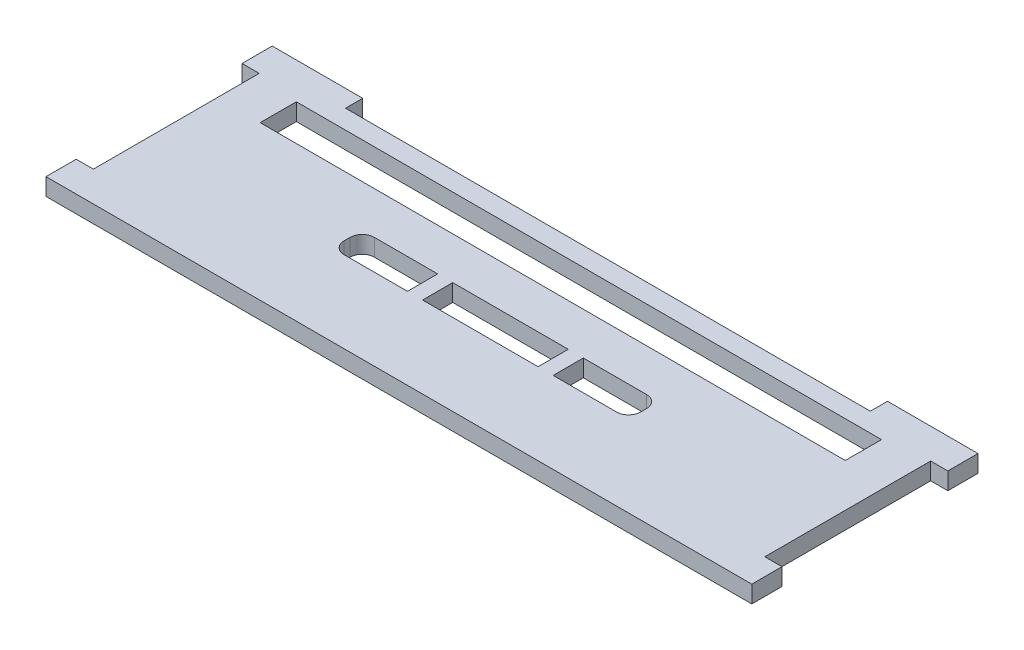
from build123d import *

# Parameters (mm, degrees)
SKETCH1_W           = 234
SKETCH1_H           = 75
BOSS_EXTRUDE1_DEPTH = 5.7
SKETCH2_W           = 5.7
SKETCH2_H           = 55
CUT_EXTRUDE1_DEPTH  = 5.7
SKETCH3_W           = 194
SKETCH3_H           = 12
SKETCH3_W_2         = 38.3
SKETCH3_H_2         = 10
CUT_EXTRUDE2_DEPTH  = 5.7
SKETCH4_W           = 174
SKETCH4_H           = 5.7
CUT_EXTRUDE3_DEPTH  = 5.7
SKETCH6_R           = 1.5
CUT_EXTRUDE4_DEPTH  = 3
SKETCH7_R           = 1.5
CUT_EXTRUDE5_DEPTH  = 3


with BuildPart() as part:
    # Sketch1 → Boss-Extrude1 (new body)
    with BuildSketch(Plane(origin=(0, 0, 0), x_dir=(1, 0, 0), z_dir=(0, 1, 0))):
        with Locations((117, 37.5)):
            Rectangle(SKETCH1_W, SKETCH1_H)
    extrude(amount=BOSS_EXTRUDE1_DEPTH)

    # Sketch2 → Cut-Extrude1 (cut)
    with BuildSketch(Plane(origin=(0, 5.7, 0), x_dir=(1, 0, 0), z_dir=(0, 1, 0))):
        with Locations((2.85, 37.5)):
            Rectangle(SKETCH2_W, SKETCH2_H)
        with Locations((231.15, 37.5)):
            Rectangle(SKETCH2_W, SKETCH2_H)
    extrude(amount=-CUT_EXTRUDE1_DEPTH, mode=Mode.SUBTRACT)

    # Sketch3 → Cut-Extrude2 (cut)
    with BuildSketch(Plane(origin=(0, 5.7, 0), x_dir=(1, 0, 0), z_dir=(0, 1, 0))):
        with Locations((117, 57)):
            Rectangle(SKETCH3_W, SKETCH3_H)
        with Locations((117, 32)):
            Rectangle(SKETCH3_W_2, SKETCH3_H_2)
        with BuildLine():
            Line((92.85, 27), (71.85, 27))
            ThreePointArc((71.85, 27), (69.021572875, 28.171572875), (67.85, 31))
            Line((67.85, 31), (67.85, 33))
            ThreePointArc((67.85, 33), (69.021572875, 35.828427125), (71.85, 37))
            Line((71.85, 37), (92.85, 37))
            Line((92.85, 37), (92.85, 27))
        make_face()
        with BuildLine():
            Line((162.15, 27), (141.15, 27))
            Line((141.15, 27), (141.15, 37))
            Line((141.15, 37), (162.15, 37))
            ThreePointArc((162.15, 37), (164.978427125, 35.828427125), (166.15, 33))
            Line((166.15, 33), (166.15, 31))
            ThreePointArc((166.15, 31), (164.978427125, 28.171572875), (162.15, 27))
        make_face()
    extrude(amount=-CUT_EXTRUDE2_DEPTH, mode=Mode.SUBTRACT)

    # Sketch4 → Cut-Extrude3 (cut)
    with BuildSketch(Plane(origin=(0, 5.7, 0), x_dir=(1, 0, 0), z_dir=(0, 1, 0))):
        with Locations((117, 72.15)):
            Rectangle(SKETCH4_W, SKETCH4_H)
    extrude(amount=-CUT_EXTRUDE3_DEPTH, mode=Mode.SUBTRACT)

    # Sketch6 → Cut-Extrude4 (cut)
    with BuildSketch(Plane.XZ):
        with Locations(Location((152, -66, 0), (0, 0, 270))):
            Circle(SKETCH6_R)
        with Locations(Location((82, -66, 0), (0, 0, 270))):
            Circle(SKETCH6_R)
        with Locations(Location((82, -43.5, 0), (0, 0, 270))):
            Circle(SKETCH6_R)
        with Locations(Location((152, -43.5, 0), (0, 0, 270))):
            Circle(SKETCH6_R)
    extrude(amount=-CUT_EXTRUDE4_DEPTH, mode=Mode.SUBTRACT)

    # Sketch7 → Cut-Extrude5 (cut)
    with BuildSketch(Plane.XZ):
        with Locations(Location((205, -66, 0), (0, 0, 270))):
            Circle(SKETCH7_R)
        with Locations(Location((160, -66, 0), (0, 0, 270))):
            Circle(SKETCH7_R)
        with Locations(Location((160, -46, 0), (0, 0, 270))):
            Circle(SKETCH7_R)
        with Locations(Location((205, -46, 0), (0, 0, 270))):
            Circle(SKETCH7_R)
        with Locations(Location((74, -66, 0), (0, 0, 270))):
            Circle(SKETCH7_R)
        with Locations(Location((29, -66, 0), (0, 0, 270))):
            Circle(SKETCH7_R)
        with Locations(Location((29, -46, 0), (0, 0, 270))):
            Circle(SKETCH7_R)
        with Locations(Location((74, -46, 0), (0, 0, 270))):
            Circle(SKETCH7_R)
    extrude(amount=-CUT_EXTRUDE5_DEPTH, mode=Mode.SUBTRACT)


solid = part.part
